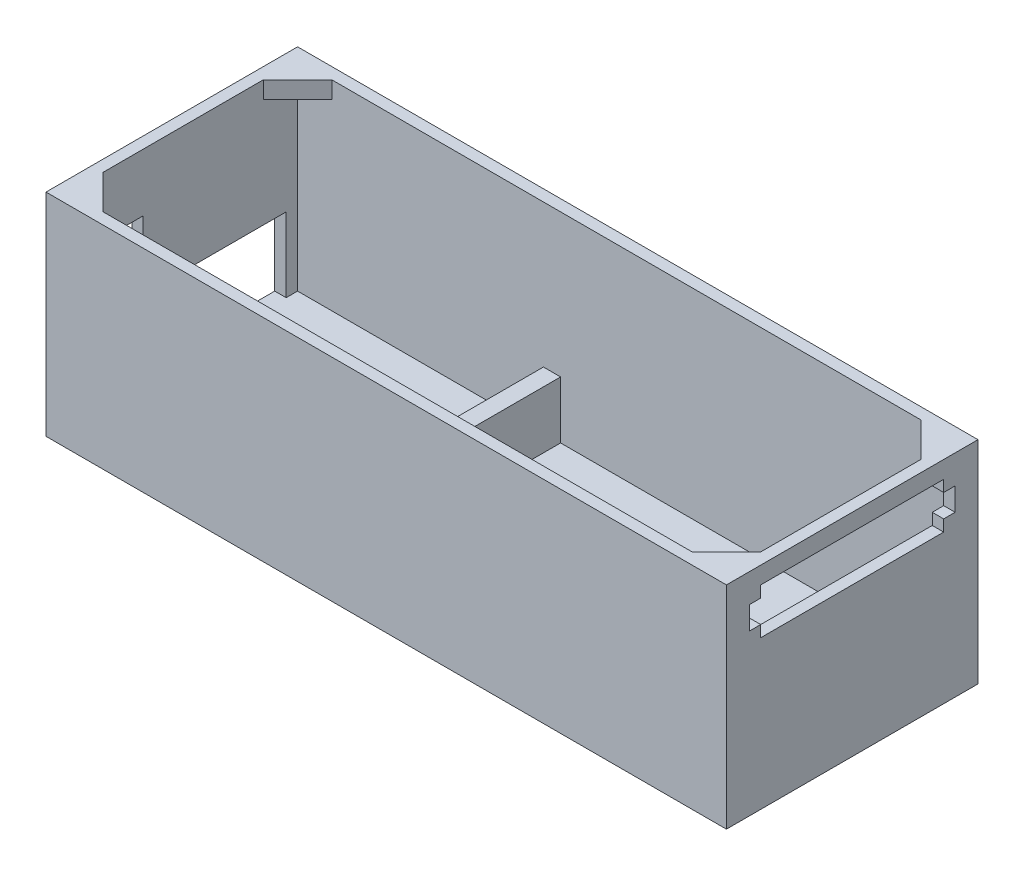
from build123d import *

# Parameters (mm, degrees)
ESBO_O1_W                = 119
ESBO_O1_H                = 44
RESSALTO_EXTRUS_O2_DEPTH = 2
ESBO_O2_W                = 119
ESBO_O2_H                = 44
ESBO_O2_W_2              = 115
ESBO_O2_H_2              = 40
RESSALTO_EXTRUS_O3_DEPTH = 35
RESSALTO_EXTRUS_O5_DEPTH = 3
ESBO_O5_W                = 3
ESBO_O5_H                = 40
RESSALTO_EXTRUS_O6_DEPTH = 7
ESBO_O8_W                = 9
ESBO_O8_H                = 4
CORTE_EXTRUS_O1_DEPTH    = 7
ESBO_O9_W                = 17
ESBO_O9_H                = 13
CORTE_EXTRUS_O2_DEPTH    = 7
CORTE_EXTRUS_O5_DEPTH    = 7
RESSALTO_EXTRUS_O7_DEPTH = 3
ESPELHAR3_COPY_1_DEPTH   = 3
ESPELHAR3_COPY_2_DEPTH   = 3
ESBO_O12_W               = 3
ESBO_O12_H               = 3
CORTE_EXTRUS_O6_DEPTH    = 6
ESBO_O13_W               = 6.5
ESBO_O13_H               = 3.5
CORTE_EXTRUS_O7_DEPTH    = 10


with BuildPart() as part:
    # Esboço1 → Ressalto-extrusão2 (new body)
    with BuildSketch(Plane(origin=(0, 0, 0), x_dir=(1, 0, 0), z_dir=(0, 1, 0))):
        Rectangle(ESBO_O1_W, ESBO_O1_H)
    extrude(amount=RESSALTO_EXTRUS_O2_DEPTH)

    # Esboço2 → Ressalto-extrusão3 (add)
    with BuildSketch(Plane(origin=(0, 2, 0), x_dir=(1, 0, 0), z_dir=(0, 1, 0))):
        Rectangle(ESBO_O2_W, ESBO_O2_H)
        Rectangle(ESBO_O2_W_2, ESBO_O2_H_2, mode=Mode.SUBTRACT)
    extrude(amount=RESSALTO_EXTRUS_O3_DEPTH)

    # Esboço3 → Ressalto-extrusão5 (add)
    with BuildSketch(Plane(origin=(0, 2, 0), x_dir=(1, 0, 0), z_dir=(0, 1, 0))):
        Polygon((-57.5, -15), (-57.5, -20), (-14.5, -20), (-14.5, -1), (-57.5, -1), (-57.5, -6), (-46.5, -6), (-46.5, -15), align=None)
        Polygon((-14.5, -1), (-14.5, -20), (-11.5, -20), (-11.5, 20), (-14.5, 20), align=None)
    extrude(amount=RESSALTO_EXTRUS_O5_DEPTH)

    # Esboço5 → Ressalto-extrusão6 (add)
    with BuildSketch(Plane(origin=(0, 5, 0), x_dir=(1, 0, 0), z_dir=(0, 1, 0))):
        with Locations((-13, 0)):
            Rectangle(ESBO_O5_W, ESBO_O5_H)
    extrude(amount=RESSALTO_EXTRUS_O6_DEPTH)

    # Esboço8 → Corte-extrusão1 (cut)
    with BuildSketch(Plane(origin=(-57.5, 0, 0), x_dir=(0, 0, -1), z_dir=(1, 0, 0))):
        with Locations((-10.5, 4)):
            Rectangle(ESBO_O8_W, ESBO_O8_H)
    extrude(amount=-CORTE_EXTRUS_O1_DEPTH, mode=Mode.SUBTRACT)

    # Esboço9 → Corte-extrusão2 (cut)
    with BuildSketch(Plane(origin=(-57.5, 0, 0), x_dir=(0, 0, -1), z_dir=(1, 0, 0))):
        with Locations((9.5, 8.5)):
            Rectangle(ESBO_O9_W, ESBO_O9_H)
    extrude(amount=-CORTE_EXTRUS_O2_DEPTH, mode=Mode.SUBTRACT)

    # Esboço10 → Corte-extrusão5 (cut)
    with BuildSketch(Plane(origin=(59.5, 0, 0), x_dir=(0, 0, -1), z_dir=(1, 0, 0))):
        Polygon((-16, 26), (16, 26), (16, 28), (18, 28), (18, 32), (16, 32), (16, 34), (-16, 34), (-16, 32), (-18, 32), (-18, 28), (-16, 28), align=None)
    extrude(amount=-CORTE_EXTRUS_O5_DEPTH, mode=Mode.SUBTRACT)

    # Esboço11 → Ressalto-extrusão7 (add)
    with BuildSketch(Plane(origin=(0, 37, 0), x_dir=(1, 0, 0), z_dir=(0, 1, 0))):
        Polygon((-59.5, 22), (-59.5, 12), (-49.5, 22), align=None)
    ressalto_extrus_o7 = extrude(amount=-RESSALTO_EXTRUS_O7_DEPTH)

    # Espelhar1: Ressalto-extrusão7 across plane
    add(ressalto_extrus_o7.mirror(Plane.XY))

    # Espelhar2: Ressalto-extrusão7 across plane
    add(ressalto_extrus_o7.mirror(Plane(origin=(0, 0, 0), x_dir=(0, 0, 1), z_dir=(1, 0, 0))))

    # Espelhar3 copy 1 sketch → Espelhar3 copy 1 (add)
    with BuildSketch(Plane(origin=(0, 37, 0), x_dir=(-1, 0, 0), z_dir=(0, 1, 0))):
        Polygon((-59.5, 22), (-59.5, 12), (-49.5, 22), align=None)
    extrude(amount=-ESPELHAR3_COPY_1_DEPTH)

    # Espelhar3 copy 2 sketch → Espelhar3 copy 2 (add)
    with BuildSketch(Plane(origin=(0, 37, 0), x_dir=(-1, 0, 0), z_dir=(0, 1, 0))):
        Polygon((-59.5, -22), (-59.5, -12), (-49.5, -22), align=None)
    extrude(amount=-ESPELHAR3_COPY_2_DEPTH)

    # Esboço12 → Corte-extrusão6 (cut)
    with BuildSketch(Plane(origin=(0, 12, 0), x_dir=(1, 0, 0), z_dir=(0, 1, 0))):
        with Locations((-13, 0.25)):
            Rectangle(ESBO_O12_W, ESBO_O12_H)
    extrude(amount=-CORTE_EXTRUS_O6_DEPTH, mode=Mode.SUBTRACT)

    # Esboço13 → Corte-extrusão7 (cut)
    with BuildSketch(Plane.ZY.offset(59.5)):
        with Locations((10.25, 25.155612263)):
            Rectangle(ESBO_O13_W, ESBO_O13_H)
    extrude(amount=-CORTE_EXTRUS_O7_DEPTH, mode=Mode.SUBTRACT)


solid = part.part
